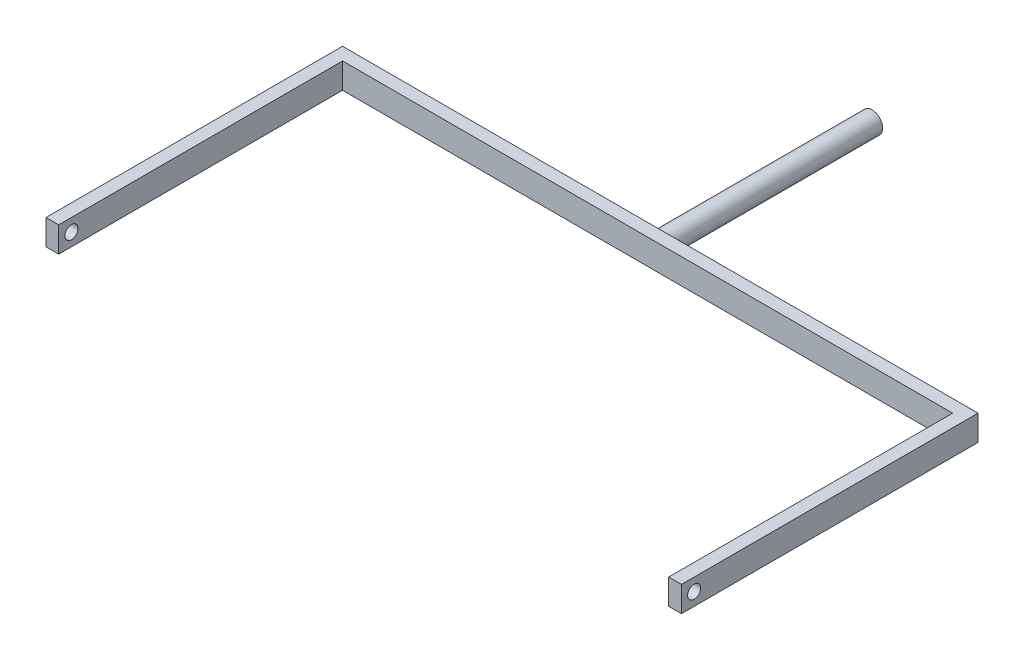
from build123d import *

# Parameters (mm, degrees)
EXTRUDE_2_DEPTH     = 6
SKETCH_2_R          = 1.55
CUT_EXTRUDE_1_DEPTH = 10
SKETCH_3_R          = 1.55
CUT_EXTRUDE_2_DEPTH = 10
SKETCH_5_R          = 2.5
EXTRUDE_3_DEPTH     = 50


with BuildPart() as part:
    # 草图1 → 凸台-拉伸2 (new body)
    with BuildSketch(Plane(origin=(0, 0, 0), x_dir=(1, 0, 0), z_dir=(0, 1, 0))):
        Polygon((-72.757575758, -68.484848485), (-72.757575758, -1.484848485), (71.242424242, -1.484848485), (71.242424242, -68.484848485), (74.242424242, -68.484848485), (74.242424242, -1.484848485), (74.242424242, 1.515151515), (71.242424242, 1.515151515), (-72.757575758, 1.515151515), (-75.757575758, 1.515151515), (-75.757575758, -1.484848485), (-75.757575758, -68.484848485), align=None)
    extrude(amount=EXTRUDE_2_DEPTH)

    # 草图2 → 切除-拉伸1 (cut)
    with BuildSketch(Plane(origin=(-72.757575758, 0, 0), x_dir=(0, 0, -1), z_dir=(1, 0, 0))):
        with Locations((-65.484848485, 3)):
            Circle(SKETCH_2_R)
    extrude(amount=-CUT_EXTRUDE_1_DEPTH, mode=Mode.SUBTRACT)

    # 草图3 → 切除-拉伸2 (cut)
    with BuildSketch(Plane(origin=(74.242424242, 0, 0), x_dir=(0, 0, -1), z_dir=(1, 0, 0))):
        with Locations((-65.484848485, 3)):
            Circle(SKETCH_3_R)
    extrude(amount=-CUT_EXTRUDE_2_DEPTH, mode=Mode.SUBTRACT)

    # 草图5 → 凸台-拉伸3 (add)
    with BuildSketch(Plane(origin=(0, 0, -1.515151515), x_dir=(-1, 0, 0), z_dir=(0, 0, -1))):
        with Locations(Location((0.757575758, 3, 0), (0, 0, 180))):
            Circle(SKETCH_5_R)
    extrude(amount=EXTRUDE_3_DEPTH)


solid = part.part
